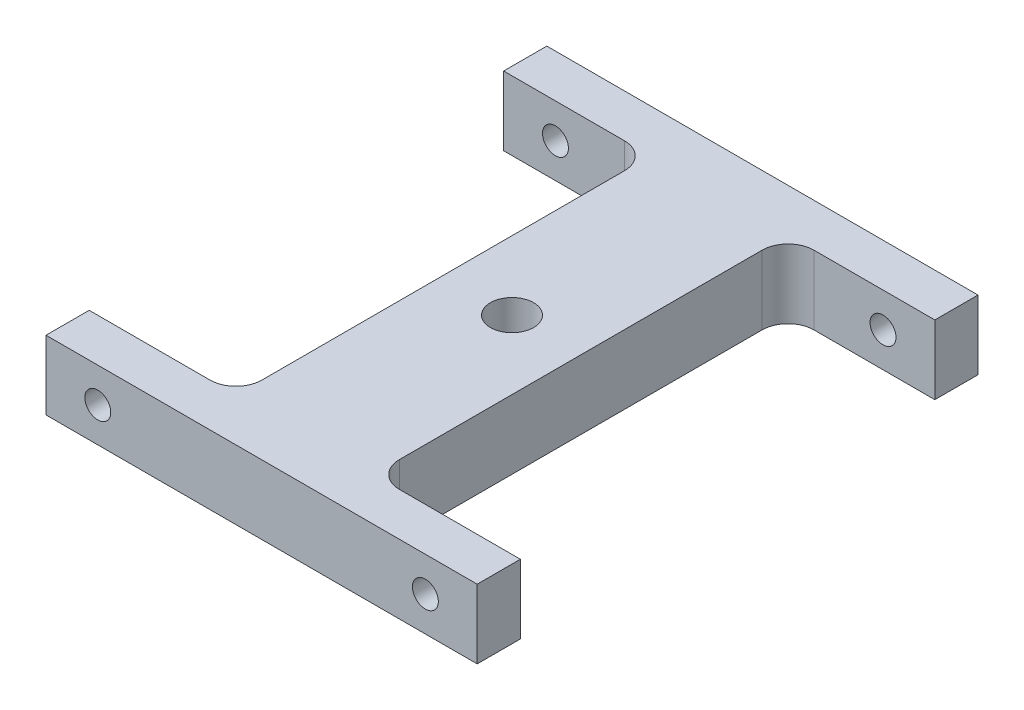
from build123d import *

# Parameters (mm, degrees)
SKETCH_1_W               = 49.93556627
SKETCH_1_H               = 8
EXTRUDE_1_DEPTH          = 58
CUT_EXTRUDE_1_DEPTH      = 56
CUT_EXTRUDE_2_DEPTH      = 66
CUT_EXTRUDE_2_DEPTH_BACK = 10
SKETCH_4_R               = 1.5
SKETCH_3_R               = 2.5
CUT_EXTRUDE_3_DEPTH      = 8


with BuildPart() as part:
    # 草图1 → 凸台-拉伸1 (new body)
    with BuildSketch(Plane.XY):
        with Locations((0, -106)):
            Rectangle(SKETCH_1_W, SKETCH_1_H)
    extrude(amount=EXTRUDE_1_DEPTH)

    # 草图2 → 切除-拉伸1 (cut)
    with BuildSketch(Plane.XZ.offset(110)):
        with BuildLine():
            Line((-24.967783135, 53), (-10.967783135, 53))
            ThreePointArc((-10.967783135, 53), (-8.846462792, 52.121320344), (-7.967783135, 50))
            Line((-7.967783135, 50), (-7.967783135, 8))
            ThreePointArc((-7.967783135, 8), (-8.846462792, 5.878679656), (-10.967783135, 5))
            Line((-10.967783135, 5), (-24.967783135, 5))
            Line((-24.967783135, 5), (-24.967783135, 53))
        make_face()
        with BuildLine():
            Line((24.967783135, 5), (10.967783135, 5))
            ThreePointArc((10.967783135, 5), (8.846462792, 5.878679656), (7.967783135, 8))
            Line((7.967783135, 8), (7.967783135, 50))
            ThreePointArc((7.967783135, 50), (8.846462792, 52.121320344), (10.967783135, 53))
            Line((10.967783135, 53), (24.967783135, 53))
            Line((24.967783135, 53), (24.967783135, 5))
        make_face()
    extrude(amount=-CUT_EXTRUDE_1_DEPTH, mode=Mode.SUBTRACT)

    # 草图4 → 切除-拉伸2 (cut, two sides: drawn at the far end of the back side and taken through both)
    with BuildSketch(Plane(origin=(0, 0, 53), x_dir=(-1, 0, 0), z_dir=(0, 0, -1)).offset(-CUT_EXTRUDE_2_DEPTH_BACK)):
        with Locations((18.967783135, -106)):
            Circle(SKETCH_4_R)
        with Locations(Location((-18.967783135, -106, 0), (0, 0, 180))):
            Circle(SKETCH_4_R)
    extrude(amount=CUT_EXTRUDE_2_DEPTH + CUT_EXTRUDE_2_DEPTH_BACK, mode=Mode.SUBTRACT)

    # 草图3 → 切除-拉伸3 (cut)
    with BuildSketch(Plane.XZ.offset(110)):
        with Locations(Location((0, 29, 0), (0, 0, 270))):
            Circle(SKETCH_3_R)
    extrude(amount=-CUT_EXTRUDE_3_DEPTH, mode=Mode.SUBTRACT)


solid = part.part
